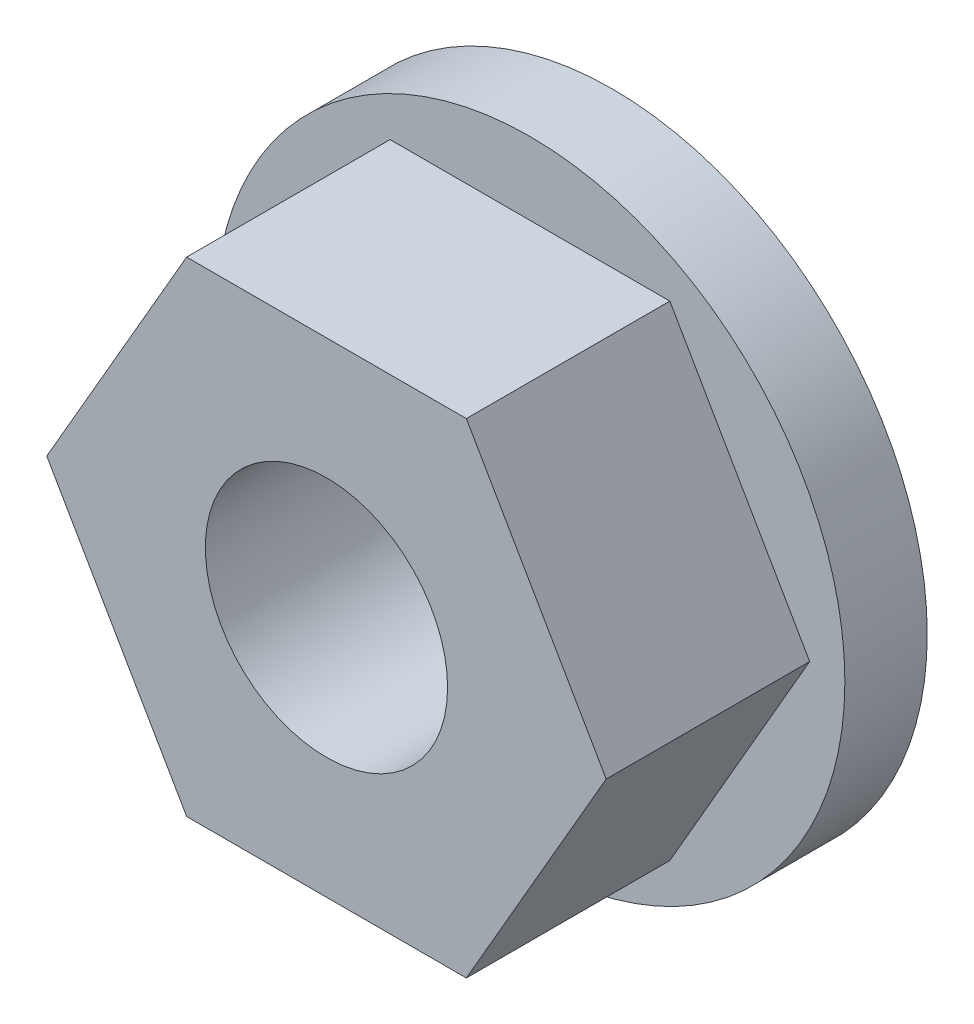
from build123d import *

# Parameters (mm, degrees)
SKETCH_1_R          = 6.5
EXTRUDE_1_DEPTH     = 1.7
EXTRUDE_2_DEPTH     = 4.2
SKETCH_3_R          = 2.5
CUT_EXTRUDE_1_DEPTH = 11.9229117


with BuildPart() as part:
    # Эскиз1 → Бобышка-Вытянуть1 (new body)
    with BuildSketch(Plane.XY):
        Circle(SKETCH_1_R)
    extrude(amount=EXTRUDE_1_DEPTH)

    # Эскиз2 → Бобышка-Вытянуть2 (add)
    with BuildSketch(Plane.XY.offset(1.7)):
        Polygon((5.773502692, 0), (2.886751346, 5), (-2.886751346, 5), (-5.773502692, 0), (-2.886751346, -5), (2.886751346, -5), align=None)
    extrude(amount=EXTRUDE_2_DEPTH)

    # Эскиз3 → Вырез-Вытянуть1 (cut, through all)
    with BuildSketch(Plane.XY.offset(5.9)):
        Circle(SKETCH_3_R)
    extrude(amount=-CUT_EXTRUDE_1_DEPTH, mode=Mode.SUBTRACT)


solid = part.part
